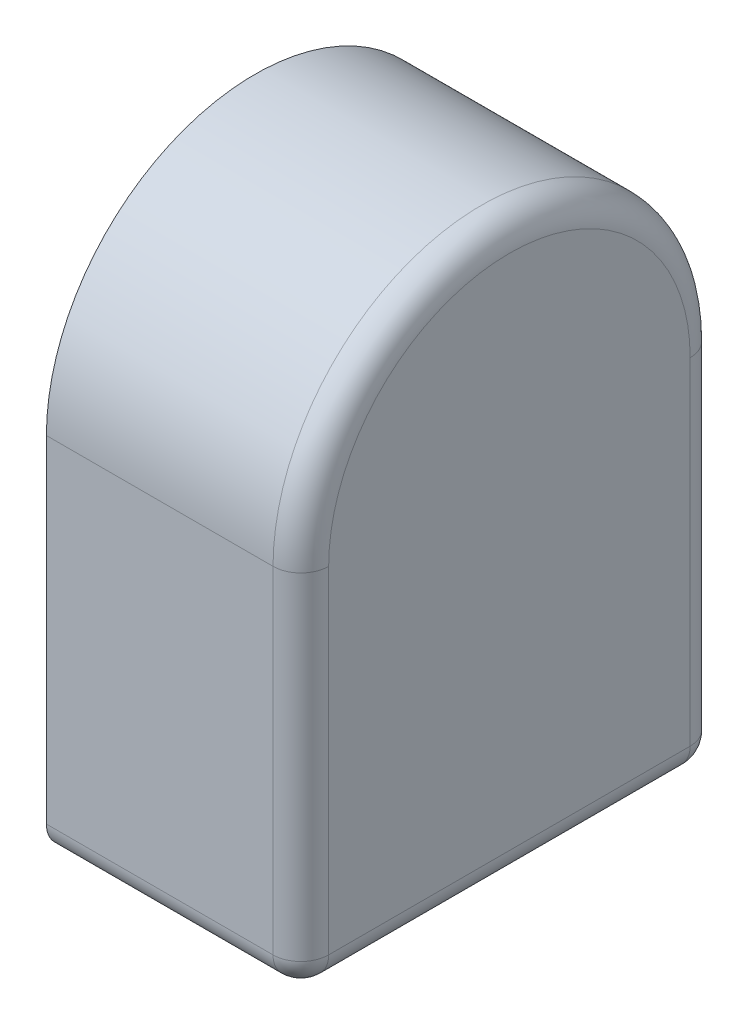
from build123d import *

# Parameters (mm, degrees)
EXTRUDE1_DEPTH     = 18.3
SKETCH2_R          = 3.01
CUT_EXTRUDE1_DEPTH = 15.5
FILLET1_R          = 2


with BuildPart() as part:
    # Sketch1 → Extrude1 (new body)
    with BuildSketch(Plane(origin=(0, 0, 0), x_dir=(0, 0, -1), z_dir=(1, 0, 0))):
        with BuildLine():
            Line((0, 0), (30, 0))
            Line((30, 0), (30, 26.2))
            ThreePointArc((30, 26.2), (15, 41.2), (0, 26.2))
            Line((0, 26.2), (0, 0))
        make_face()
    extrude(amount=EXTRUDE1_DEPTH)

    # Sketch2 → Cut-Extrude1 (cut)
    with BuildSketch(Plane.ZY):
        with Locations((-15, 26.2)):
            Circle(SKETCH2_R)
    extrude(amount=-CUT_EXTRUDE1_DEPTH, mode=Mode.SUBTRACT)

    # Fillet1
    fillet1_edges = [part.edges().sort_by_distance(p)[0] for p in [
        (18.3, 13.1, -30),
        (18.3, 41.2, -15),
        (18.3, 13.1, 0),
        (18.3, 0, -15),
        (9.15, 0, -30),
        (9.15, 0, 0),
    ]]
    fillet(fillet1_edges, radius=FILLET1_R)


solid = part.part
